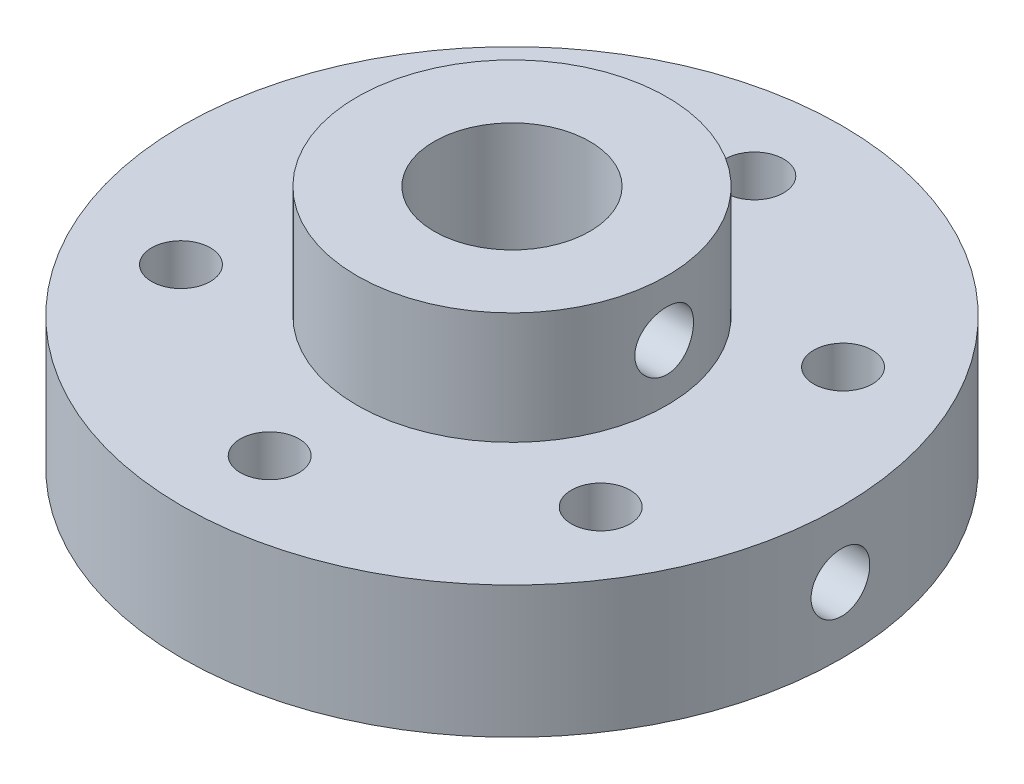
from build123d import *

# Parameters (mm, degrees)
SKETCH8_R                      = 12.7
BOSS_EXTRUDE6_DEPTH            = 5.08
SKETCH9_R                      = 5.969
BOSS_EXTRUDE7_DEPTH            = 4.318
F_4_40_TAPPED_HOLE1_D          = 2.2606
CIRPATTERN1_COUNT              = 6
SKETCH12_R                     = 3
CUT_EXTRUDE2_DEPTH             = 21.270727762
SKETCH13_W                     = 1.1303
SKETCH13_H                     = 12.7
F_4_40_TAPPED_HOLE2_AT_2_COUNT = 2
F_4_40_TAPPED_HOLE2_AT_2_PITCH = 4.699


with BuildPart() as part:
    # Sketch8 → Boss-Extrude6 (new body)
    with BuildSketch(Plane(origin=(0, 0, 0), x_dir=(1, 0, 0), z_dir=(0, 1, 0))):
        with Locations(Location((0, 0, 0), (0, 0, 270))):
            Circle(SKETCH8_R)
    extrude(amount=BOSS_EXTRUDE6_DEPTH)

    # Sketch9 → Boss-Extrude7 (add)
    with BuildSketch(Plane(origin=(0, 5.08, 0), x_dir=(1, 0, 0), z_dir=(0, 1, 0))):
        with Locations(Location((0, 0, 0), (0, 0, 270))):
            Circle(SKETCH9_R)
    extrude(amount=BOSS_EXTRUDE7_DEPTH)

    # #4-40 Tapped Hole1 (through all)
    with Locations(Plane(origin=(0, 5.08, 0), x_dir=(1, 0, 0), z_dir=(0, 1, 0))):
        with Locations((0, 9.3345)):
            f_4_40_tapped_hole1 = Hole(F_4_40_TAPPED_HOLE1_D / 2)

    # CirPattern1: #4-40 Tapped Hole1 ×6 about axis
    cirpattern1_axis = Axis((0, 0, 0), (0, 1, 0))
    for i in range(1, CIRPATTERN1_COUNT):
        add(f_4_40_tapped_hole1.rotate(cirpattern1_axis, i * 360 / CIRPATTERN1_COUNT), mode=Mode.SUBTRACT)

    # Sketch12 → Cut-Extrude2 (cut, through all)
    with BuildSketch(Plane(origin=(0, 9.398, 0), x_dir=(1, 0, 0), z_dir=(0, 1, 0))):
        with Locations(Location((0, 0, 0), (0, 0, 270))):
            Circle(SKETCH12_R)
    extrude(amount=-CUT_EXTRUDE2_DEPTH, mode=Mode.SUBTRACT)

    # Sketch13 → #4-40 Tapped Hole2 (revolve, cut)
    with BuildSketch(Plane.ZX.offset(7.239)):
        with Locations((0.56515, 6.35)):
            Rectangle(SKETCH13_W, SKETCH13_H)
    f_4_40_tapped_hole2 = revolve(axis=Axis((-6.35, 7.239, 0), (1, 0, 0)), mode=Mode.SUBTRACT)

    # #4-40 Tapped Hole2 at 2: #4-40 Tapped Hole2 ×2
    with Locations(*[(0, -i * F_4_40_TAPPED_HOLE2_AT_2_PITCH, 0) for i in range(1, F_4_40_TAPPED_HOLE2_AT_2_COUNT)]):
        add(f_4_40_tapped_hole2, mode=Mode.SUBTRACT)


solid = part.part
